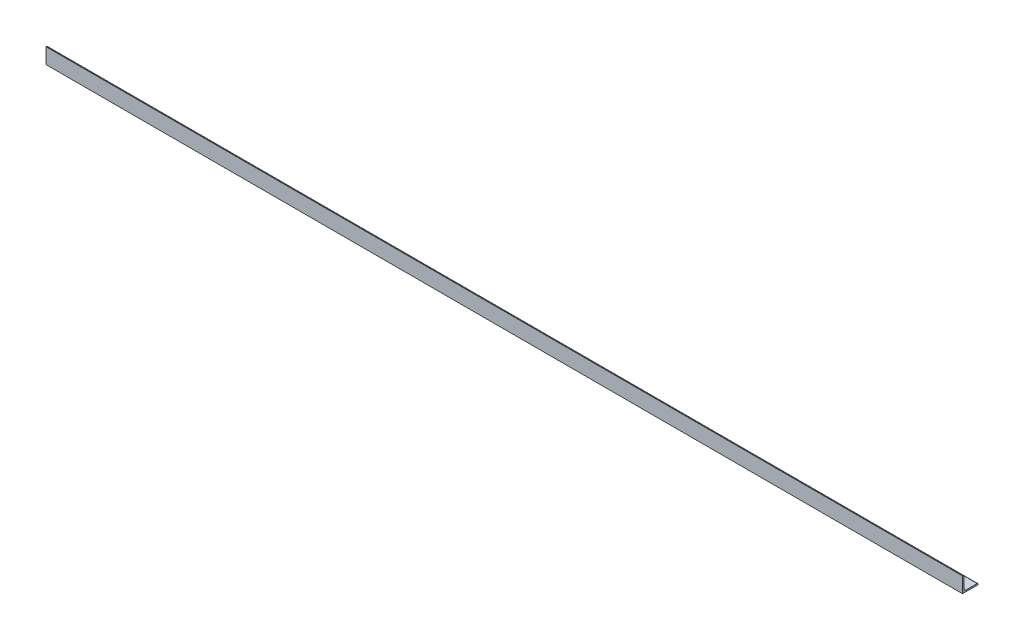
from build123d import *

# Parameters (mm, degrees)
BOSS_EXTRUDE1_DEPTH = 939.8
SKETCH2_R           = 3.556
CUT_EXTRUDE1_DEPTH  = 941.207951624
FILLET1_R           = 1
FILLET2_R           = 2
SKETCH4_R           = 3.5687
CUT_EXTRUDE2_DEPTH  = 941.23360821


with BuildPart() as part:
    # Sketch1 → Boss-Extrude1 (new body)
    with BuildSketch(Plane(origin=(0, 0, 0), x_dir=(0, 0, -1), z_dir=(1, 0, 0))):
        Polygon((7.856463982, 11.336121381), (7.856463982, -4.538878619), (23.731463982, -4.538878619), (23.731463982, -2.938678619), (9.456663982, -2.938678619), (9.456663982, 11.336121381), align=None)
    extrude(amount=BOSS_EXTRUDE1_DEPTH)

    # Sketch2 → Cut-Extrude1 (cut, through all)
    with BuildSketch(Plane(origin=(0, -2.938678619, 0), x_dir=(1, 0, 0), z_dir=(0, 1, 0))):
        with Locations(Location((12.7, 15.793963982, 0), (0, 0, 270))):
            Circle(SKETCH2_R)
        with Locations(Location((38.1, 15.793963982, 0), (0, 0, 270))):
            Circle(SKETCH2_R)
        with Locations(Location((927.1, 15.793963982, 0), (0, 0, 270))):
            Circle(SKETCH2_R)
        with Locations(Location((901.7, 15.793963982, 0), (0, 0, 270))):
            Circle(SKETCH2_R)
    extrude(amount=-CUT_EXTRUDE1_DEPTH, mode=Mode.SUBTRACT)

    # Fillet1
    fillet1_edges = [part.edges().sort_by_distance(p)[0] for p in [
        (469.9, 11.336121381, -9.456663982),
        (469.9, -2.938678619, -23.731463982),
    ]]
    fillet(fillet1_edges, radius=FILLET1_R)

    # Fillet2
    fillet2_edges = [part.edges().sort_by_distance(p)[0] for p in [
        (469.9, -2.938678619, -9.456663982),
    ]]
    fillet(fillet2_edges, radius=FILLET2_R)

    # Sketch4 → Cut-Extrude2 (cut, through all)
    with BuildSketch(Plane.XZ.offset(4.538878619)):
        with Locations((469.900000001, -20.233163939)):
            Circle(SKETCH4_R)
    extrude(amount=-CUT_EXTRUDE2_DEPTH, mode=Mode.SUBTRACT)


solid = part.part
